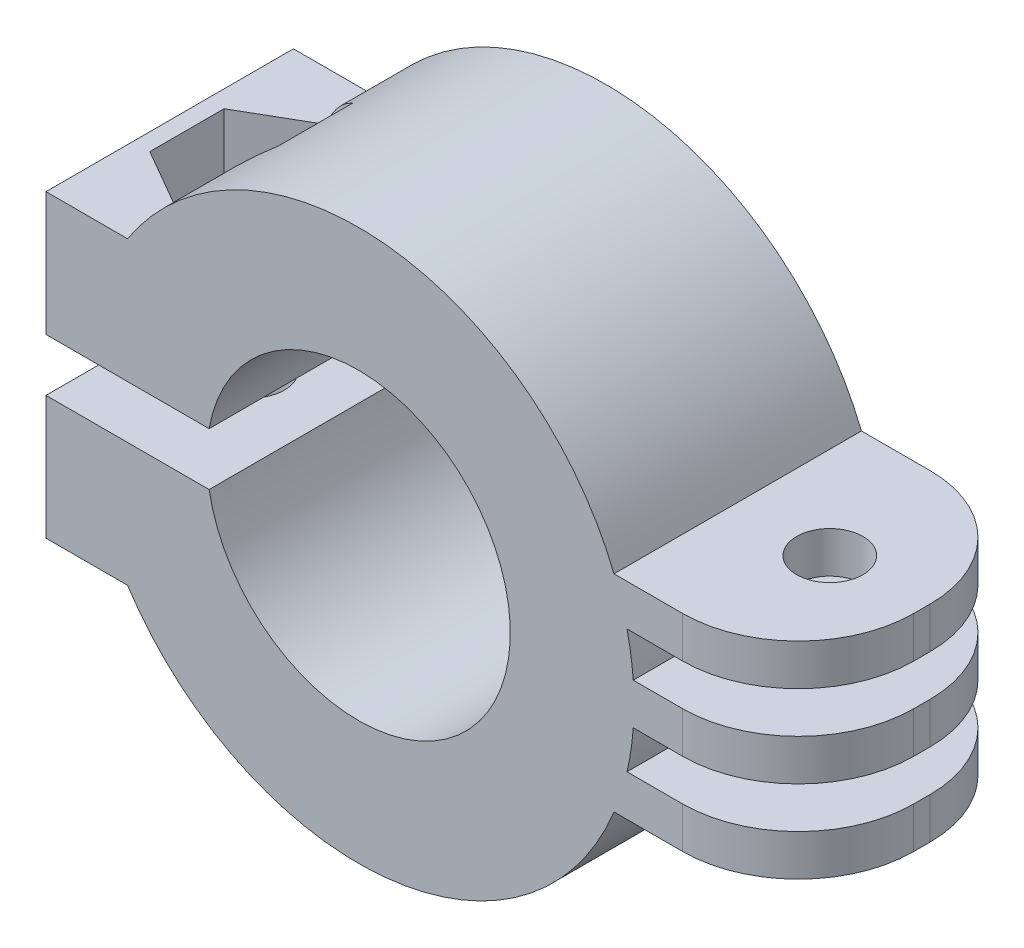
from build123d import *

# Parameters (mm, degrees)
BODY_DEPTH                    = 19.05
SKETCH4_R                     = 5.9436
F_10_HEAD_CLEARANCE_DEPTH     = 49.85841003
F_10_NUT_CLEARANCE_DEPTH      = 51.814361521
F_10_NUT_CLEARANCE_DEPTH_BACK = 4.7625
FILLET2_R                     = 8.89
F_10_CLEARANCE_HOLE1_D        = 5.1054


with BuildPart() as part:
    # Sketch1 → Body (new body)
    with BuildSketch(Plane.XY):
        with BuildLine():
            ThreePointArc((-11.506493967, -2.02890428), (8.950462938, -7.510330831), (0, 11.684))
            ThreePointArc((0, 11.684), (-7.510330831, 8.950462938), (-11.506493967, 2.02890428))
            Line((-11.506493967, 2.02890428), (-24.064785284, 2.02890428))
            Line((-24.064785284, 2.02890428), (-24.064785284, 11.55390428))
            Line((-24.064785284, 11.55390428), (-17.785639626, 11.55390428))
            ThreePointArc((-17.785639626, 11.55390428), (21.209, 0), (-17.785639626, -11.55390428))
            Line((-17.785639626, -11.55390428), (-24.064785284, -11.55390428))
            Line((-24.064785284, -11.55390428), (-24.064785284, -2.02890428))
            Line((-24.064785284, -2.02890428), (-11.506493967, -2.02890428))
        make_face()
        with BuildLine():
            ThreePointArc((20.667372227, -4.7625), (20.229911928, -6.369642406), (19.667683513, -7.9375))
            Line((19.667683513, -7.9375), (33.849504125, -7.9375))
            Line((33.849504125, -7.9375), (33.849504125, -4.7625))
            Line((33.849504125, -4.7625), (20.667372227, -4.7625))
        make_face()
        with BuildLine():
            Line((33.849504125, 1.5875), (21.149504125, 1.5875))
            ThreePointArc((21.149504125, 1.5875), (21.209, 0), (21.149504125, -1.5875))
            Line((21.149504125, -1.5875), (33.849504125, -1.5875))
            Line((33.849504125, -1.5875), (33.849504125, 1.5875))
        make_face()
        with BuildLine():
            Line((33.849504125, 7.9375), (19.667683513, 7.9375))
            ThreePointArc((19.667683513, 7.9375), (20.229911928, 6.369642406), (20.667372227, 4.7625))
            Line((20.667372227, 4.7625), (33.849504125, 4.7625))
            Line((33.849504125, 4.7625), (33.849504125, 7.9375))
        make_face()
    extrude(amount=BODY_DEPTH)

    # Sketch3 → CBORE for #10 Binding Head Machine Screw1 (revolve, cut)
    with BuildSketch(Plane(origin=(-17.785639626, -11.55390428, 9.525), x_dir=(0, 0, -1), z_dir=(1, 0, 0))):
        Polygon((0, 0), (0, 32.76290428), (2.5527, 32.76290428), (2.5527, 3.1242), (5.9436, 3.1242), (5.9436, 0), align=None)
    revolve(axis=Axis((-17.785639626, -17.90390428, 9.525), (0, 1, 0)), mode=Mode.SUBTRACT)

    # Sketch4 → #10 Head clearance (cut, through all)
    with BuildSketch(Plane.XZ.offset(8.42970428)):
        with Locations(Location((-17.785639626, 9.525, 0), (0, 0, 270))):
            Circle(SKETCH4_R)
    extrude(amount=F_10_HEAD_CLEARANCE_DEPTH, mode=Mode.SUBTRACT)

    # Sketch5 → #10 nut clearance (cut, two sides: drawn at the far end of the back side and taken through both)
    with BuildSketch(Plane(origin=(0, 11.55390428, 0), x_dir=(1, 0, 0), z_dir=(0, 1, 0)).offset(-F_10_NUT_CLEARANCE_DEPTH_BACK)):
        with BuildLine():
            Line((-17.785639626, -3.805768233), (-22.738639626, -6.665384117))
            Line((-22.738639626, -6.665384117), (-22.738639626, -12.384615883))
            Line((-22.738639626, -12.384615883), (-17.785639626, -15.244231767))
            Line((-17.785639626, -15.244231767), (-17.785639626, -12.0777))
            ThreePointArc((-17.785639626, -12.0777), (-20.338339626, -9.525), (-17.785639626, -6.9723))
            Line((-17.785639626, -6.9723), (-17.785639626, -3.805768233))
        make_face()
        with BuildLine():
            Line((-12.832639626, -6.665384117), (-17.785639626, -3.805768233))
            Line((-17.785639626, -3.805768233), (-17.785639626, -6.9723))
            ThreePointArc((-17.785639626, -6.9723), (-20.338339626, -9.525), (-17.785639626, -12.0777))
            Line((-17.785639626, -12.0777), (-17.785639626, -15.244231767))
            Line((-17.785639626, -15.244231767), (-12.832639626, -12.384615883))
            Line((-12.832639626, -12.384615883), (-12.832639626, -6.665384117))
        make_face()
    extrude(amount=F_10_NUT_CLEARANCE_DEPTH + F_10_NUT_CLEARANCE_DEPTH_BACK, mode=Mode.SUBTRACT)

    # Fillet2
    fillet2_edges = [part.edges().sort_by_distance(p)[0] for p in [
        (33.849504125, 6.35, 0),
        (33.849504125, 0, 0),
        (33.849504125, -6.35, 0),
        (33.849504125, -6.35, 19.05),
        (33.849504125, 0, 19.05),
        (33.849504125, 6.35, 19.05),
    ]]
    fillet(fillet2_edges, radius=FILLET2_R)

    # #10 Clearance Hole1 (through all)
    with Locations(Plane(origin=(0, -7.9375, 0), x_dir=(-1, 0, 0), z_dir=(0, -1, 0))):
        with Locations((-26.758593819, -9.525)):
            Hole(F_10_CLEARANCE_HOLE1_D / 2)


solid = part.part
